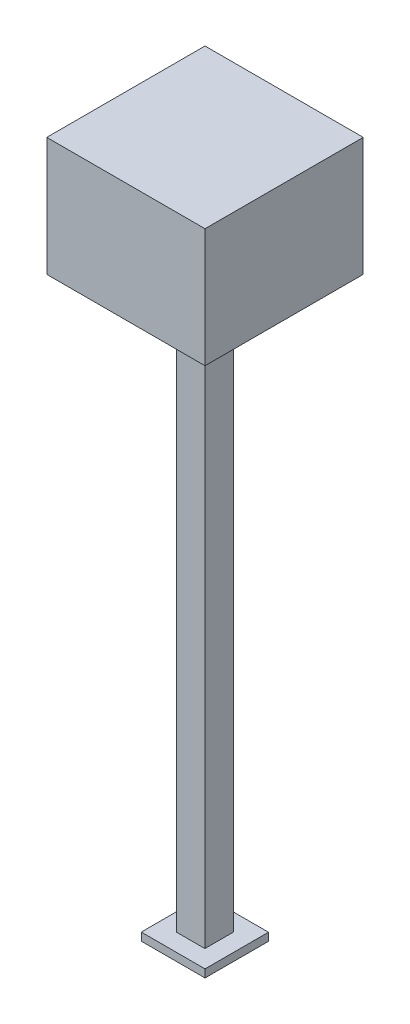
from build123d import *

# Parameters (mm, degrees)
SKETCH1_W           = 18
SKETCH1_H           = 18
BOSS_EXTRUDE1_DEPTH = 360
SKETCH2_W           = 100
SKETCH2_H           = 100
BOSS_EXTRUDE2_DEPTH = 75
SKETCH3_W           = 40.291443712
SKETCH3_H           = 40.114806418
BOSS_EXTRUDE3_DEPTH = 5


with BuildPart() as part:
    # Sketch1 → Boss-Extrude1 (new body)
    with BuildSketch(Plane(origin=(0, 0, 0), x_dir=(1, 0, 0), z_dir=(0, 1, 0))):
        with Locations((-9, 9)):
            Rectangle(SKETCH1_W, SKETCH1_H)
    extrude(amount=BOSS_EXTRUDE1_DEPTH)

    # Sketch2 → Boss-Extrude2 (add)
    with BuildSketch(Plane(origin=(0, 360, 0), x_dir=(1, 0, 0), z_dir=(0, 1, 0))):
        with Locations((-8.961373057, 9.036735776)):
            Rectangle(SKETCH2_W, SKETCH2_H)
    extrude(amount=BOSS_EXTRUDE2_DEPTH)

    # Sketch3 → Boss-Extrude3 (add)
    with BuildSketch(Plane(origin=(0, 0, 0), x_dir=(-1, 0, 0), z_dir=(0, -1, 0))):
        with Locations((9, 9)):
            Rectangle(SKETCH3_W, SKETCH3_H)
    extrude(amount=BOSS_EXTRUDE3_DEPTH)


solid = part.part
